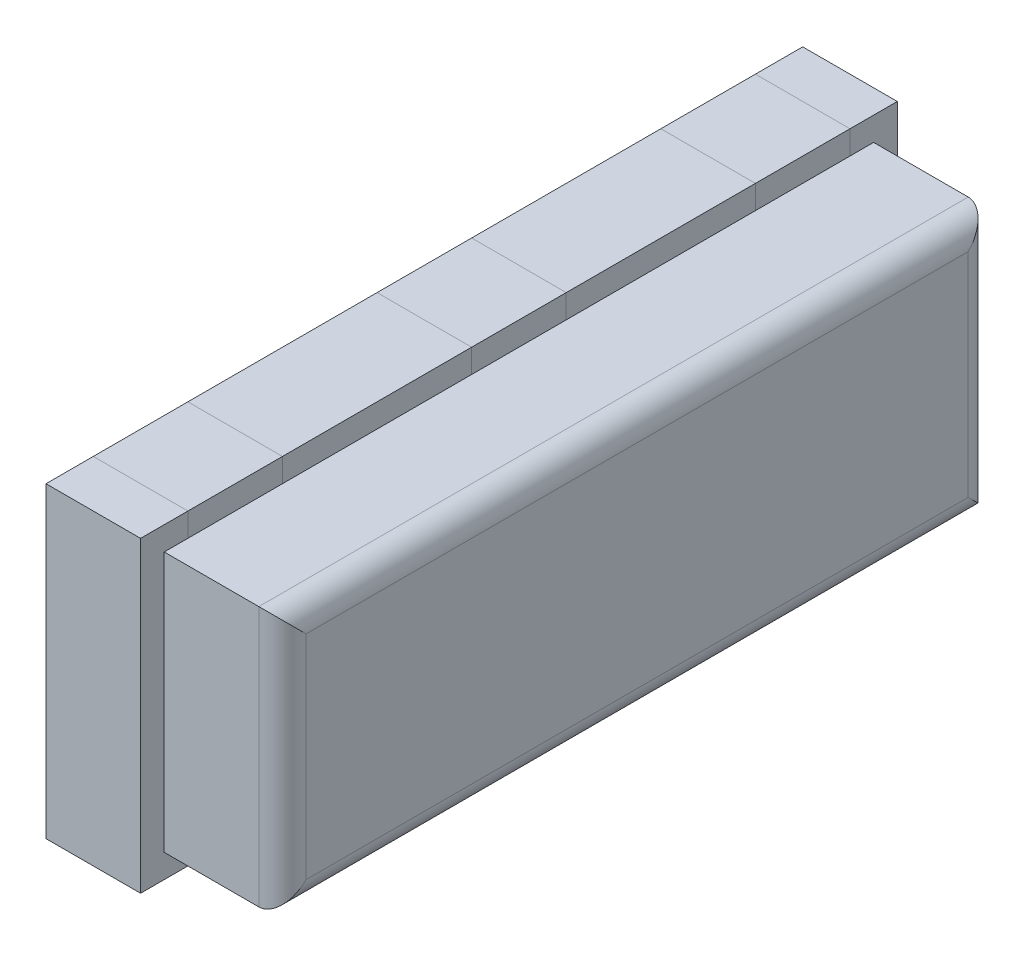
from build123d import *

# Parameters (mm, degrees)
SKETCH1_W             = 3.2
SKETCH1_H             = 1.3
BOSS_EXTRUDE1_DEPTH   = 0.4
SKETCH2_W             = 3
SKETCH2_H             = 1.1
BOSS_EXTRUDE2_DEPTH   = 0.5
SKETCH3_W             = 0.4
SKETCH3_H             = 1.3
CUT_EXTRUDE1_DEPTH    = 0.4
SKETCH3_2_W           = 0.4
SKETCH3_2_H           = 1.3
BOSS_EXTRUDE3_DEPTH   = 0.4
BOSS_EXTRUDE3_2_DEPTH = 0.4
BOSS_EXTRUDE3_3_DEPTH = 0.4
FILLET1_R             = 0.1


with BuildPart() as part:
    # Sketch1 → Boss-Extrude1 (new body)
    with BuildSketch(Plane(origin=(0, 0, 0), x_dir=(0, 0, -1), z_dir=(1, 0, 0))):
        Rectangle(SKETCH1_W, SKETCH1_H)
    extrude(amount=BOSS_EXTRUDE1_DEPTH)

    # Sketch2 → Boss-Extrude2 (add)
    with BuildSketch(Plane(origin=(0.4, 0, 0), x_dir=(0, 0, -1), z_dir=(1, 0, 0))):
        Rectangle(SKETCH2_W, SKETCH2_H)
    extrude(amount=BOSS_EXTRUDE2_DEPTH)

    # Sketch3 → Cut-Extrude1 (cut)
    with BuildSketch(Plane.ZY):
        with Locations((1.2, 0)):
            Rectangle(SKETCH3_W, SKETCH3_H)
        Rectangle(SKETCH3_W, SKETCH3_H)
        with Locations((-1.2, 0)):
            Rectangle(SKETCH3_W, SKETCH3_H)
    extrude(amount=-CUT_EXTRUDE1_DEPTH, mode=Mode.SUBTRACT)

    # Fillet1
    fillet1_edges = [part.edges().sort_by_distance(p)[0] for p in [
        (0.9, 0.55, 0),
        (0.9, 0, 1.5),
        (0.9, -0.55, 0),
        (0.9, 0, -1.5),
    ]]
    fillet(fillet1_edges, radius=FILLET1_R)


with BuildPart() as body_2:
    # Sketch3<2> → Boss-Extrude3 (new body)
    with BuildSketch(Plane.ZY):
        with Locations((1.2, 0)):
            Rectangle(SKETCH3_2_W, SKETCH3_2_H)
    extrude(amount=-BOSS_EXTRUDE3_DEPTH)


with BuildPart() as body_3:
    # Sketch3<2> → Boss-Extrude3 2 (new body)
    with BuildSketch(Plane.ZY):
        Rectangle(SKETCH3_2_W, SKETCH3_2_H)
    extrude(amount=-BOSS_EXTRUDE3_2_DEPTH)


with BuildPart() as body_4:
    # Sketch3<2> → Boss-Extrude3 3 (new body)
    with BuildSketch(Plane.ZY):
        with Locations((-1.2, 0)):
            Rectangle(SKETCH3_2_W, SKETCH3_2_H)
    extrude(amount=-BOSS_EXTRUDE3_3_DEPTH)


solid = Compound([part.part, body_2.part, body_3.part, body_4.part])
